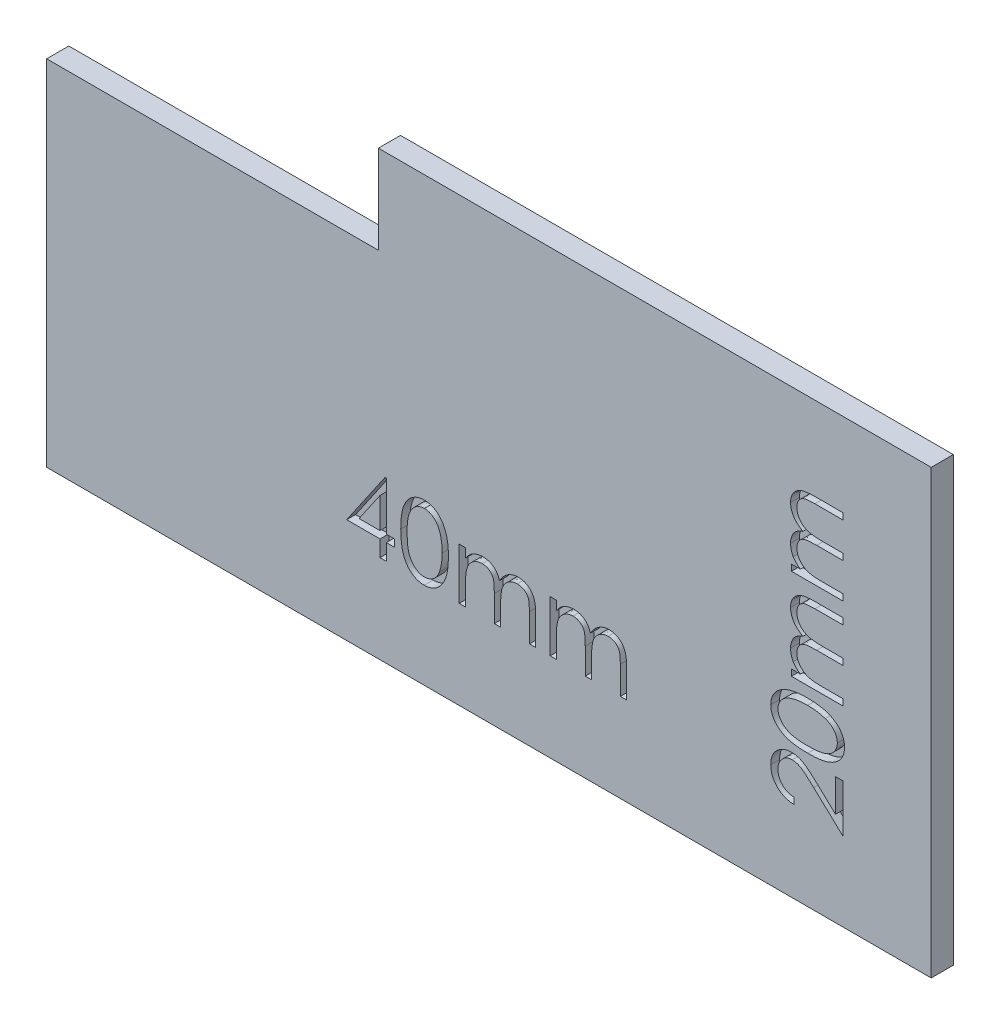
from build123d import *

# Parameters (mm, degrees)
SKETCH1_W           = 40
SKETCH1_H           = 20
BOSS_EXTRUDE1_DEPTH = 1
CUT_EXTRUDE1_REACH  = 46.733
SKETCH3_W           = 15
SKETCH3_H           = 4
CUT_EXTRUDE2_DEPTH  = 0.4


with BuildPart() as part:
    # Sketch1 → Boss-Extrude1 (new body)
    with BuildSketch(Plane.XY):
        with Locations((20, 10)):
            Rectangle(SKETCH1_W, SKETCH1_H)
    extrude(amount=BOSS_EXTRUDE1_DEPTH)

    # Sketch3 → Cut-Extrude1 (cut, up to next)
    with BuildSketch(Plane.XY.offset(1), mode=Mode.PRIVATE) as cut_extrude1_sk1:
        with Locations((7.5, 18)):
            Rectangle(SKETCH3_W, SKETCH3_H)
    cut_extrude1_tool1 = extrude(cut_extrude1_sk1.sketch, amount=-CUT_EXTRUDE1_REACH, mode=Mode.PRIVATE) & part.part
    add(cut_extrude1_tool1.solids().sort_by_distance((7.5, 18, 1))[0], mode=Mode.SUBTRACT)

    # Sketch2 → Cut-Extrude2 (cut)
    # profile 1 of 8: a face of its own
    with BuildSketch(Plane.XY.offset(1)):
        Polygon((15.30173778, 7.256410256), (15.359615385, 7.256410256), (15.359615385, 5.058333333), (15.725961538, 5.058333333), (15.725961538, 4.732692308), (15.359615385, 4.732692308), (15.359615385, 4), (15.074679487, 4), (15.074679487, 4.732692308), (13.568589744, 4.732692308), align=None)
        Polygon((15.074679487, 5.058333333), (15.074679487, 6.437219551), (14.128285256, 5.058333333), align=None, mode=Mode.SUBTRACT)
    # profile 2 of 8: a face of its own
    with BuildSketch(Plane.XY.offset(1)):
        with BuildLine():
            add(Edge.make_bspline(
                [(16.010897436, 5.586227965), (16.011194995, 5.637116309), (16.011773009, 5.735967652), (16.018203219, 5.880008006), (16.028885137, 6.015136268), (16.043524039, 6.141358907), (16.061338493, 6.258708507), (16.085119684, 6.366871466), (16.112164155, 6.466348394), (16.143508159, 6.557463681), (16.178875654, 6.641444883), (16.21736959, 6.719844887), (16.260517654, 6.792545069), (16.305853853, 6.860705779), (16.355213375, 6.923211273), (16.407191564, 6.98094426), (16.463817123, 7.032570441), (16.523165138, 7.079602444), (16.58577293, 7.120831607), (16.64985592, 7.15714702), (16.715855195, 7.188171185), (16.783950947, 7.212564652), (16.853531124, 7.232713063), (16.924838963, 7.246491609), (16.997992201, 7.25516109), (17.047369288, 7.255989917), (17.072410857, 7.256410256)],
                knots=[0, 0, 0, 0, 1.646270934, 3.197905019, 4.663502075, 6.030701355, 7.308322542, 8.50163776, 9.611534131, 10.641858119, 11.616356847, 12.558055219, 13.465016945, 14.349605745, 15.204443733, 16.039544428, 16.859896111, 17.680448484, 18.487036065, 19.28249412, 20.06191084, 20.843045899, 21.620316918, 22.403196591, 23.190181807, 24, 24, 24, 24], degree=3))
            add(Edge.make_bspline(
                [(17.072410857, 7.256410256), (17.097661613, 7.255967738), (17.147877421, 7.255087709), (17.222118333, 7.246629561), (17.294644115, 7.232595043), (17.36514557, 7.212709587), (17.434201808, 7.188039223), (17.501272692, 7.157117338), (17.56677483, 7.121122937), (17.629667305, 7.07882842), (17.690640563, 7.031673069), (17.74819693, 6.978366934), (17.802341643, 6.91944826), (17.853754242, 6.855547427), (17.900976105, 6.785438814), (17.94594629, 6.7103418), (17.986198065, 6.628943087), (18.024964521, 6.542600805), (18.058426287, 6.448925915), (18.088603524, 6.348446454), (18.112986588, 6.239975584), (18.133296857, 6.124082419), (18.149031155, 6.000341345), (18.160490766, 5.869017616), (18.166544208, 5.730024833), (18.167684215, 5.634994498), (18.168269231, 5.586227965)],
                knots=[0, 0, 0, 0, 0.810914788, 1.612654377, 2.396697861, 3.181598691, 3.963628158, 4.749916497, 5.551656086, 6.361998678, 7.18212741, 8.025565596, 8.878627764, 9.750805457, 10.657531673, 11.591944965, 12.560506719, 13.57287815, 14.630710178, 15.753379473, 16.941251878, 18.199788006, 19.531962791, 20.947069417, 22.433333509, 24, 24, 24, 24], degree=3))
            add(Edge.make_bspline(
                [(18.168269231, 5.586227965), (18.167678151, 5.537674134), (18.166526455, 5.443068975), (18.160558628, 5.30470159), (18.148803298, 5.174074794), (18.134098523, 5.050875303), (18.113732292, 4.935615891), (18.088690463, 4.827897713), (18.060886242, 4.727255591), (18.026564678, 4.634514012), (17.988999248, 4.548379235), (17.948127749, 4.467945464), (17.904340121, 4.392501756), (17.856634616, 4.322651986), (17.805786163, 4.257901347), (17.750706455, 4.199392789), (17.692948138, 4.145716537), (17.631795447, 4.097953989), (17.567922111, 4.056148487), (17.502644948, 4.018761637), (17.434805736, 3.988614835), (17.365941843, 3.962729477), (17.295068254, 3.942953353), (17.222273314, 3.929279212), (17.1479273, 3.919689035), (17.097670166, 3.918957443), (17.072410857, 3.918589744)],
                knots=[0, 0, 0, 0, 1.561518951, 3.042555995, 4.452378317, 5.7783523, 7.031515105, 8.214008947, 9.334062868, 10.386615937, 11.391082383, 12.354592575, 13.286541444, 14.194233754, 15.072674879, 15.931287219, 16.775624067, 17.606195743, 18.42308326, 19.229000347, 20.022332153, 20.807536673, 21.593273796, 22.3848459, 23.188221202, 24, 24, 24, 24], degree=3))
            add(Edge.make_bspline(
                [(17.072410857, 3.918589744), (17.047369983, 3.919012795), (16.997994265, 3.919846969), (16.924830993, 3.928477282), (16.853817634, 3.942352489), (16.784603764, 3.961780408), (16.716834283, 3.98556101), (16.651432651, 4.01654328), (16.587671681, 4.052224899), (16.525721484, 4.092860746), (16.466746166, 4.139416844), (16.41041386, 4.190910163), (16.358139736, 4.248625686), (16.309485949, 4.311652088), (16.263245169, 4.379409529), (16.220709809, 4.452823125), (16.181366248, 4.531601779), (16.145403939, 4.616254455), (16.11351908, 4.708016425), (16.085354373, 4.807937466), (16.06311653, 4.916899507), (16.044081992, 5.034027404), (16.028729159, 5.15982447), (16.018247735, 5.294358997), (16.011769543, 5.437547151), (16.011193443, 5.535763303), (16.010897436, 5.586227965)],
                knots=[0, 0, 0, 0, 0.810891512, 1.598919785, 2.382837074, 3.152667961, 3.926044502, 4.706494248, 5.493654104, 6.291793342, 7.103789334, 7.925228297, 8.761435821, 9.622817696, 10.50288917, 11.416980706, 12.369136599, 13.353924996, 14.394355917, 15.514179734, 16.714354668, 17.994756427, 19.357759367, 20.818452758, 22.365282078, 24, 24, 24, 24], degree=3))
        make_face()
        with BuildLine():
            add(Edge.make_bspline(
                [(16.295833333, 5.5875), (16.295941689, 5.545092252), (16.296151986, 5.46278714), (16.301645825, 5.343186467), (16.309129964, 5.231634812), (16.318783141, 5.127990532), (16.333118672, 5.03260445), (16.349181259, 4.944820523), (16.368728454, 4.865103315), (16.391856077, 4.792905801), (16.418198687, 4.727002717), (16.446960435, 4.665678758), (16.477858376, 4.608209501), (16.512437891, 4.555111156), (16.550097984, 4.506210565), (16.589988012, 4.46064221), (16.633596714, 4.420004948), (16.693925109, 4.371267015), (16.773569053, 4.32090323), (16.873917609, 4.27704642), (16.977031133, 4.249485191), (17.047018338, 4.245980213), (17.081951122, 4.244230769)],
                knots=[0, 0, 0, 0, 1.459021318, 2.831673884, 4.118529203, 5.306027144, 6.411944654, 7.436330062, 8.375795394, 9.233974572, 10.042671642, 10.816086306, 11.563610507, 12.285937304, 12.993564865, 13.685989202, 14.367179055, 15.041617293, 16.353048772, 17.594441528, 18.799311195, 20, 20, 20, 20], degree=3))
            add(Edge.make_bspline(
                [(17.081951122, 4.244230769), (17.117109867, 4.245680185), (17.187354767, 4.248576023), (17.289983281, 4.276514878), (17.389615026, 4.318669388), (17.467694572, 4.368514626), (17.527096594, 4.415983896), (17.569657006, 4.456455755), (17.608720436, 4.501772864), (17.645770032, 4.550667225), (17.679750765, 4.604072978), (17.710650897, 4.661733315), (17.738847934, 4.723808354), (17.754912569, 4.767142332), (17.763126002, 4.789297877)],
                knots=[0, 0, 0, 0, 1.353760809, 2.704726607, 4.075137775, 5.516104923, 6.260822281, 7.007110065, 7.778089737, 8.566572457, 9.372053459, 10.217411131, 11.088608312, 12, 12, 12, 12], degree=3))
            add(Edge.make_bspline(
                [(17.763126002, 4.789297877), (17.772697962, 4.817627712), (17.792133148, 4.875149426), (17.817180972, 4.964379311), (17.836907155, 5.057998961), (17.854653923, 5.155448888), (17.866767052, 5.25744776), (17.876516854, 5.36367998), (17.882259691, 5.474225644), (17.882971573, 5.549332529), (17.883333333, 5.5875)],
                knots=[0, 0, 0, 0, 0.884706709, 1.796334032, 2.740027952, 3.714592787, 4.726048262, 5.777819803, 6.87074269, 8, 8, 8, 8], degree=3))
            add(Edge.make_bspline(
                [(17.883333333, 5.5875), (17.882834233, 5.625661298), (17.881857886, 5.700312955), (17.878125912, 5.809640161), (17.868488812, 5.913478773), (17.857785326, 6.01227613), (17.842003561, 6.105485333), (17.82498755, 6.193886682), (17.802126451, 6.276384997), (17.777706369, 6.354271903), (17.749756939, 6.426662497), (17.718990523, 6.493894289), (17.686132213, 6.556291861), (17.650443181, 6.613684015), (17.612347097, 6.666327822), (17.570838463, 6.713167775), (17.527563782, 6.755655596), (17.466951049, 6.804153784), (17.387599372, 6.853603679), (17.28886082, 6.89911119), (17.186108164, 6.925244427), (17.116645102, 6.928928957), (17.081951122, 6.930769231)],
                knots=[0, 0, 0, 0, 1.31362396, 2.569729283, 3.763502607, 4.902122613, 5.988968491, 7.01645872, 7.998833611, 8.933434873, 9.825090667, 10.667526885, 11.477055099, 12.250526234, 12.991942729, 13.710640831, 14.402115721, 15.076753259, 16.378508321, 17.609869233, 18.806226677, 20, 20, 20, 20], degree=3))
            add(Edge.make_bspline(
                [(17.081951122, 6.930769231), (17.046835085, 6.928926418), (16.976539037, 6.925237437), (16.872718393, 6.899208557), (16.773200874, 6.853839652), (16.694059033, 6.80399), (16.633404026, 6.756511674), (16.590693297, 6.715339677), (16.550646412, 6.670303432), (16.513754999, 6.620953123), (16.479202578, 6.567916683), (16.447469802, 6.510776875), (16.418879081, 6.449244137), (16.392495252, 6.383370657), (16.36929708, 6.311179371), (16.350161842, 6.231560356), (16.332484301, 6.144055639), (16.319970021, 6.048152943), (16.308845043, 5.944482704), (16.301695534, 5.832652565), (16.296133608, 5.712851306), (16.29593543, 5.630120641), (16.295833333, 5.5875)],
                knots=[0, 0, 0, 0, 1.207732386, 2.417664972, 3.655092373, 4.956220595, 5.625982001, 6.301752483, 6.994047911, 7.697131622, 8.419323945, 9.170223765, 9.943494443, 10.752040957, 11.610060368, 12.549350801, 13.567764191, 14.679664412, 15.874934091, 17.154273443, 18.533957287, 20, 20, 20, 20], degree=3))
        make_face(mode=Mode.SUBTRACT)
    # profile 3 of 8: a face of its own
    with BuildSketch(Plane.XY.offset(1)):
        with BuildLine():
            Line((18.656730769, 6.320192308), (18.941666667, 6.320192308))
            Line((18.941666667, 6.320192308), (18.941666667, 5.916957131))
            add(Edge.make_bspline(
                [(18.941666667, 5.916957131), (18.96732425, 5.952233742), (19.016486639, 6.019827109), (19.097100481, 6.108899724), (19.177633097, 6.184490264), (19.235629808, 6.224171297), (19.263491587, 6.243234175)],
                knots=[0, 0, 0, 0, 1.134379233, 2.173579362, 3.122582517, 4, 4, 4, 4], degree=3))
            add(Edge.make_bspline(
                [(19.263491587, 6.243234175), (19.301468816, 6.261381899), (19.376759768, 6.297360285), (19.495975779, 6.333857871), (19.617963515, 6.35628707), (19.700339537, 6.359354459), (19.741776843, 6.360897436)],
                knots=[0, 0, 0, 0, 1.014936303, 2.012140481, 3.000054389, 4, 4, 4, 4], degree=3))
            add(Edge.make_bspline(
                [(19.741776843, 6.360897436), (19.769801204, 6.359949208), (19.825259908, 6.358072715), (19.907432618, 6.345862541), (19.98713293, 6.324756798), (20.063889943, 6.295358726), (20.136207988, 6.259756374), (20.202510331, 6.21798271), (20.262040863, 6.171086078), (20.314769495, 6.11694876), (20.362184968, 6.05405056), (20.405799351, 5.980695134), (20.446099365, 5.895235327), (20.468434409, 5.833217108), (20.480193309, 5.800565905)],
                knots=[0, 0, 0, 0, 1.009824226, 1.998387844, 2.986035974, 3.974953746, 4.955485308, 5.885931332, 6.793869504, 7.679848016, 8.601185859, 9.625726857, 10.749998409, 12, 12, 12, 12], degree=3))
            add(Edge.make_bspline(
                [(20.480193309, 5.800565905), (20.492631373, 5.822994486), (20.517107736, 5.867130782), (20.558206421, 5.929595063), (20.601266493, 5.988021224), (20.646654926, 6.042455623), (20.694211516, 6.09262945), (20.744160072, 6.13870859), (20.796216266, 6.180890926), (20.868599227, 6.230169792), (20.962772092, 6.282513007), (21.08150631, 6.327895953), (21.205013966, 6.355941298), (21.288850021, 6.359234474), (21.331184896, 6.360897436)],
                knots=[0, 0, 0, 0, 0.86119277, 1.694706429, 2.50939023, 3.298075842, 4.073795165, 4.829715201, 5.57930267, 6.321991688, 7.768977793, 9.186738141, 10.579381044, 12, 12, 12, 12], degree=3))
            add(Edge.make_bspline(
                [(21.331184896, 6.360897436), (21.370084509, 6.359430386), (21.446214827, 6.356559226), (21.557047061, 6.334013575), (21.660408556, 6.295298852), (21.756091332, 6.242472625), (21.842414877, 6.176088651), (21.917450386, 6.097104777), (21.980742073, 6.006079683), (22.022088411, 5.920452665), (22.050132972, 5.844855613), (22.067424234, 5.780442763), (22.082700243, 5.70954814), (22.09538323, 5.632086974), (22.104652917, 5.547785637), (22.111520637, 5.456782085), (22.116168904, 5.359005591), (22.116497355, 5.291545459), (22.116666667, 5.256770833)],
                knots=[0, 0, 0, 0, 1.209669288, 2.367440248, 3.500751976, 4.631527125, 5.755587489, 6.87532382, 8.007944318, 9.190864318, 9.82315674, 10.514484317, 11.263564316, 12.079023757, 12.955305781, 13.901327259, 14.918167583, 16, 16, 16, 16], degree=3))
            Line((22.116666667, 5.256770833), (22.116666667, 4))
            Line((22.116666667, 4), (21.831730769, 4))
            Line((21.831730769, 4), (21.831730769, 5.258042869))
            add(Edge.make_bspline(
                [(21.831730769, 5.258042869), (21.831660118, 5.287725104), (21.831524338, 5.344769845), (21.829080829, 5.426641711), (21.824476794, 5.501270864), (21.819093229, 5.568555544), (21.811614916, 5.628652659), (21.801957535, 5.681441496), (21.791727069, 5.727337311), (21.774730848, 5.778215368), (21.747563832, 5.834340488), (21.706182261, 5.894868303), (21.654048665, 5.947555886), (21.593850523, 5.993292502), (21.525317291, 6.030479591), (21.449784292, 6.057037114), (21.367720473, 6.073477153), (21.310912658, 6.075115467), (21.281575521, 6.075961538)],
                knots=[0, 0, 0, 0, 1.253487763, 2.409012846, 3.458416907, 4.410876679, 5.259312806, 6.014470957, 6.676830364, 7.243083969, 8.276244668, 9.299465089, 10.325150304, 11.392391894, 12.482080715, 13.603491619, 14.762376348, 16, 16, 16, 16], degree=3))
            add(Edge.make_bspline(
                [(21.281575521, 6.075961538), (21.245589205, 6.074676881), (21.174466564, 6.072137911), (21.070648159, 6.046217326), (20.970888737, 6.007137384), (20.878165009, 5.950502227), (20.79286837, 5.882640354), (20.719480896, 5.801950363), (20.658854556, 5.710664644), (20.617802735, 5.626167278), (20.591868155, 5.55026714), (20.574744096, 5.483957381), (20.561424162, 5.40859053), (20.548932325, 5.324673021), (20.540779171, 5.231627214), (20.533369291, 5.129883522), (20.529903222, 5.01913593), (20.529418392, 4.942367434), (20.529166667, 4.902509014)],
                knots=[0, 0, 0, 0, 1.090531906, 2.155305635, 3.229839962, 4.33261226, 5.44038871, 6.529323825, 7.629011124, 8.757537029, 9.370236727, 10.061839251, 10.834451254, 11.692844982, 12.636905849, 13.66920014, 14.789842145, 16, 16, 16, 16], degree=3))
            Line((20.529166667, 4.902509014), (20.529166667, 4))
            Line((20.529166667, 4), (20.244230769, 4))
            Line((20.244230769, 4), (20.244230769, 5.1798127))
            add(Edge.make_bspline(
                [(20.244230769, 5.1798127), (20.244158714, 5.213098782), (20.244020087, 5.277137859), (20.241592285, 5.368971264), (20.236977992, 5.452501958), (20.231643495, 5.527632857), (20.223968904, 5.59422742), (20.215251477, 5.652642665), (20.204956666, 5.702732146), (20.187911557, 5.757671788), (20.161863432, 5.818197197), (20.11996408, 5.882732266), (20.067705775, 5.939218326), (20.006409337, 5.987440905), (19.937461326, 6.027302106), (19.861276384, 6.056022023), (19.778540498, 6.072735486), (19.721501437, 6.074865908), (19.692167468, 6.075961538)],
                knots=[0, 0, 0, 0, 1.320475261, 2.540461679, 3.643808994, 4.639130445, 5.527981419, 6.302341397, 6.981980563, 7.553956391, 8.582137848, 9.585246428, 10.591171744, 11.620968678, 12.668337649, 13.738356861, 14.836885341, 16, 16, 16, 16], degree=3))
            add(Edge.make_bspline(
                [(19.692167468, 6.075961538), (19.657681333, 6.074573193), (19.588951692, 6.071806269), (19.487984905, 6.04690132), (19.390480035, 6.007890481), (19.297992558, 5.953770502), (19.213016723, 5.886733481), (19.138623509, 5.807889254), (19.07608279, 5.718219059), (19.034597501, 5.634612676), (19.007838171, 5.560614063), (18.990062403, 5.497702846), (18.974786456, 5.427852621), (18.963434451, 5.350847884), (18.952475788, 5.267190177), (18.947186865, 5.176462747), (18.942041948, 5.078743425), (18.941794829, 5.011276902), (18.941666667, 4.976287059)],
                knots=[0, 0, 0, 0, 1.098833095, 2.189935336, 3.297829714, 4.440610912, 5.596351641, 6.740013378, 7.886572111, 9.072425424, 9.705826452, 10.395263256, 11.156850408, 11.985370555, 12.878090359, 13.847760091, 14.883794034, 16, 16, 16, 16], degree=3))
            Line((18.941666667, 4.976287059), (18.941666667, 4))
            Line((18.941666667, 4), (18.656730769, 4))
            Line((18.656730769, 4), (18.656730769, 6.320192308))
        make_face()
    # profile 4 of 8: a face of its own
    with BuildSketch(Plane.XY.offset(1)):
        with BuildLine():
            Line((22.767948718, 6.320192308), (23.052884615, 6.320192308))
            Line((23.052884615, 6.320192308), (23.052884615, 5.916957131))
            add(Edge.make_bspline(
                [(23.052884615, 5.916957131), (23.078542199, 5.952233742), (23.127704588, 6.019827109), (23.20831843, 6.108899724), (23.288851046, 6.184490264), (23.346847756, 6.224171297), (23.374709535, 6.243234175)],
                knots=[0, 0, 0, 0, 1.134379233, 2.173579362, 3.122582517, 4, 4, 4, 4], degree=3))
            add(Edge.make_bspline(
                [(23.374709535, 6.243234175), (23.412686765, 6.261381899), (23.487977716, 6.297360285), (23.607193728, 6.333857871), (23.729181464, 6.35628707), (23.811557486, 6.359354459), (23.852994792, 6.360897436)],
                knots=[0, 0, 0, 0, 1.014936303, 2.012140481, 3.000054389, 4, 4, 4, 4], degree=3))
            add(Edge.make_bspline(
                [(23.852994792, 6.360897436), (23.881019153, 6.359949208), (23.936477857, 6.358072715), (24.018650567, 6.345862541), (24.098350879, 6.324756798), (24.175107891, 6.295358726), (24.247425936, 6.259756374), (24.31372828, 6.21798271), (24.373258812, 6.171086078), (24.425987444, 6.11694876), (24.473402917, 6.05405056), (24.517017299, 5.980695134), (24.557317313, 5.895235327), (24.579652358, 5.833217108), (24.591411258, 5.800565905)],
                knots=[0, 0, 0, 0, 1.009824226, 1.998387844, 2.986035974, 3.974953746, 4.955485308, 5.885931332, 6.793869504, 7.679848016, 8.601185859, 9.625726857, 10.749998409, 12, 12, 12, 12], degree=3))
            add(Edge.make_bspline(
                [(24.591411258, 5.800565905), (24.603849322, 5.822994486), (24.628325684, 5.867130782), (24.669424369, 5.929595063), (24.712484442, 5.988021224), (24.757872875, 6.042455623), (24.805429464, 6.09262945), (24.85537802, 6.13870859), (24.907434215, 6.180890926), (24.979817176, 6.230169792), (25.073990041, 6.282513007), (25.192724259, 6.327895953), (25.316231915, 6.355941298), (25.40006797, 6.359234474), (25.442402845, 6.360897436)],
                knots=[0, 0, 0, 0, 0.86119277, 1.694706429, 2.50939023, 3.298075842, 4.073795165, 4.829715201, 5.57930267, 6.321991688, 7.768977793, 9.186738141, 10.579381044, 12, 12, 12, 12], degree=3))
            add(Edge.make_bspline(
                [(25.442402845, 6.360897436), (25.481302457, 6.359430386), (25.557432776, 6.356559226), (25.66826501, 6.334013575), (25.771626505, 6.295298852), (25.867309281, 6.242472625), (25.953632826, 6.176088651), (26.028668335, 6.097104777), (26.091960022, 6.006079683), (26.133306359, 5.920452665), (26.161350921, 5.844855613), (26.178642183, 5.780442763), (26.193918192, 5.70954814), (26.206601179, 5.632086974), (26.215870866, 5.547785637), (26.222738586, 5.456782085), (26.227386853, 5.359005591), (26.227715304, 5.291545459), (26.227884615, 5.256770833)],
                knots=[0, 0, 0, 0, 1.209669288, 2.367440248, 3.500751976, 4.631527125, 5.755587489, 6.87532382, 8.007944318, 9.190864318, 9.82315674, 10.514484317, 11.263564316, 12.079023757, 12.955305781, 13.901327259, 14.918167583, 16, 16, 16, 16], degree=3))
            Line((26.227884615, 5.256770833), (26.227884615, 4))
            Line((26.227884615, 4), (25.942948718, 4))
            Line((25.942948718, 4), (25.942948718, 5.258042869))
            add(Edge.make_bspline(
                [(25.942948718, 5.258042869), (25.942878067, 5.287725104), (25.942742287, 5.344769845), (25.940298778, 5.426641711), (25.935694743, 5.501270864), (25.930311178, 5.568555544), (25.922832865, 5.628652659), (25.913175484, 5.681441496), (25.902945017, 5.727337311), (25.885948797, 5.778215368), (25.858781781, 5.834340488), (25.81740021, 5.894868303), (25.765266613, 5.947555886), (25.705068471, 5.993292502), (25.636535239, 6.030479591), (25.56100224, 6.057037114), (25.478938422, 6.073477153), (25.422130607, 6.075115467), (25.39279347, 6.075961538)],
                knots=[0, 0, 0, 0, 1.253487763, 2.409012846, 3.458416907, 4.410876679, 5.259312806, 6.014470957, 6.676830364, 7.243083969, 8.276244668, 9.299465089, 10.325150304, 11.392391894, 12.482080715, 13.603491619, 14.762376348, 16, 16, 16, 16], degree=3))
            add(Edge.make_bspline(
                [(25.39279347, 6.075961538), (25.356807154, 6.074676881), (25.285684513, 6.072137911), (25.181866108, 6.046217326), (25.082106685, 6.007137384), (24.989382958, 5.950502227), (24.904086319, 5.882640354), (24.830698845, 5.801950363), (24.770072505, 5.710664644), (24.729020684, 5.626167278), (24.703086104, 5.55026714), (24.685962044, 5.483957381), (24.672642111, 5.40859053), (24.660150273, 5.324673021), (24.65199712, 5.231627214), (24.64458724, 5.129883522), (24.641121171, 5.01913593), (24.640636341, 4.942367434), (24.640384615, 4.902509014)],
                knots=[0, 0, 0, 0, 1.090531906, 2.155305635, 3.229839962, 4.33261226, 5.44038871, 6.529323825, 7.629011124, 8.757537029, 9.370236727, 10.061839251, 10.834451254, 11.692844982, 12.636905849, 13.66920014, 14.789842145, 16, 16, 16, 16], degree=3))
            Line((24.640384615, 4.902509014), (24.640384615, 4))
            Line((24.640384615, 4), (24.355448718, 4))
            Line((24.355448718, 4), (24.355448718, 5.1798127))
            add(Edge.make_bspline(
                [(24.355448718, 5.1798127), (24.355376663, 5.213098782), (24.355238036, 5.277137859), (24.352810234, 5.368971264), (24.348195941, 5.452501958), (24.342861444, 5.527632857), (24.335186853, 5.59422742), (24.326469426, 5.652642665), (24.316174615, 5.702732146), (24.299129505, 5.757671788), (24.273081381, 5.818197197), (24.231182029, 5.882732266), (24.178923724, 5.939218326), (24.117627286, 5.987440905), (24.048679274, 6.027302106), (23.972494332, 6.056022023), (23.889758447, 6.072735486), (23.832719385, 6.074865908), (23.803385417, 6.075961538)],
                knots=[0, 0, 0, 0, 1.320475261, 2.540461679, 3.643808994, 4.639130445, 5.527981419, 6.302341397, 6.981980563, 7.553956391, 8.582137848, 9.585246428, 10.591171744, 11.620968678, 12.668337649, 13.738356861, 14.836885341, 16, 16, 16, 16], degree=3))
            add(Edge.make_bspline(
                [(23.803385417, 6.075961538), (23.768899282, 6.074573193), (23.70016964, 6.071806269), (23.599202853, 6.04690132), (23.501697983, 6.007890481), (23.409210507, 5.953770502), (23.324234672, 5.886733481), (23.249841458, 5.807889254), (23.187300739, 5.718219059), (23.145815449, 5.634612676), (23.119056119, 5.560614063), (23.101280351, 5.497702846), (23.086004405, 5.427852621), (23.0746524, 5.350847884), (23.063693737, 5.267190177), (23.058404814, 5.176462747), (23.053259897, 5.078743425), (23.053012778, 5.011276902), (23.052884615, 4.976287059)],
                knots=[0, 0, 0, 0, 1.098833095, 2.189935336, 3.297829714, 4.440610912, 5.596351641, 6.740013378, 7.886572111, 9.072425424, 9.705826452, 10.395263256, 11.156850408, 11.985370555, 12.878090359, 13.847760091, 14.883794034, 16, 16, 16, 16], degree=3))
            Line((23.052884615, 4.976287059), (23.052884615, 4))
            Line((23.052884615, 4), (22.767948718, 4))
            Line((22.767948718, 4), (22.767948718, 6.320192308))
        make_face()
    # profile 5 of 8: a face of its own
    with BuildSketch(Plane.XY.offset(1)):
        with BuildLine():
            Line((33.679807692, 12.767948718), (33.679807692, 13.052884615))
            Line((33.679807692, 13.052884615), (34.083042869, 13.052884615))
            add(Edge.make_bspline(
                [(34.083042869, 13.052884615), (34.047766258, 13.078542199), (33.980172891, 13.127704588), (33.891100276, 13.20831843), (33.815509736, 13.288851046), (33.775828703, 13.346847756), (33.756765825, 13.374709535)],
                knots=[0, 0, 0, 0, 1.134379233, 2.173579362, 3.122582517, 4, 4, 4, 4], degree=3))
            add(Edge.make_bspline(
                [(33.756765825, 13.374709535), (33.738618101, 13.412686765), (33.702639715, 13.487977716), (33.666142129, 13.607193728), (33.64371293, 13.729181464), (33.640645541, 13.811557486), (33.639102564, 13.852994792)],
                knots=[0, 0, 0, 0, 1.014936303, 2.012140481, 3.000054389, 4, 4, 4, 4], degree=3))
            add(Edge.make_bspline(
                [(33.639102564, 13.852994792), (33.640050807, 13.881019138), (33.641927329, 13.936477813), (33.654137287, 14.018650739), (33.675243847, 14.098350233), (33.704638871, 14.175110298), (33.740252318, 14.247417233), (33.781986994, 14.313758616), (33.828928901, 14.373030736), (33.882425774, 14.42618354), (33.945446327, 14.473559122), (34.019199176, 14.516832553), (34.104747332, 14.557348646), (34.166776911, 14.579663164), (34.199434095, 14.591411258)],
                knots=[0, 0, 0, 0, 1.009731074, 1.9982035, 2.985760524, 3.974587072, 4.955028184, 5.885388378, 6.793242796, 7.673688873, 8.594941726, 9.625945874, 10.750113716, 12, 12, 12, 12], degree=3))
            add(Edge.make_bspline(
                [(34.199434095, 14.591411258), (34.177005758, 14.603849549), (34.132869942, 14.628326359), (34.070402174, 14.669421795), (34.011988752, 14.712493737), (33.957508674, 14.75783961), (33.90739561, 14.805649855), (33.860627212, 14.855154145), (33.818498769, 14.907461094), (33.769204698, 14.979811598), (33.716676939, 15.073847292), (33.672282042, 15.192871011), (33.644009213, 15.316213342), (33.640748921, 15.400061738), (33.639102564, 15.442402845)],
                knots=[0, 0, 0, 0, 0.861026002, 1.694378253, 2.508904292, 3.297437177, 4.073006284, 4.833627155, 5.583069468, 6.325614666, 7.772320565, 9.187282923, 10.579656144, 12, 12, 12, 12], degree=3))
            add(Edge.make_bspline(
                [(33.639102564, 15.442402845), (33.640551236, 15.481309217), (33.643386428, 15.557452765), (33.666176269, 15.668117379), (33.703895541, 15.771765264), (33.756940583, 15.867297858), (33.823282236, 15.953605065), (33.902309405, 16.028911556), (33.993733461, 16.091561563), (34.079052599, 16.133444805), (34.154518194, 16.16132709), (34.219110555, 16.178740706), (34.290259971, 16.193827237), (34.367909216, 16.206618341), (34.452215505, 16.215865722), (34.543217575, 16.222740117), (34.640994503, 16.227386429), (34.708454573, 16.22771516), (34.743229167, 16.227884615)],
                knots=[0, 0, 0, 0, 1.209392158, 2.366897878, 3.497663982, 4.628180075, 5.751982922, 6.871462727, 8.009245026, 9.185977379, 9.818124946, 10.509294143, 11.264649411, 12.079922034, 12.956003306, 13.901808055, 14.918415426, 16, 16, 16, 16], degree=3))
            Line((34.743229167, 16.227884615), (36, 16.227884615))
            Line((36, 16.227884615), (36, 15.942948718))
            Line((36, 15.942948718), (34.741957131, 15.942948718))
            add(Edge.make_bspline(
                [(34.741957131, 15.942948718), (34.712274853, 15.94287841), (34.655230027, 15.942743289), (34.573358736, 15.94029527), (34.498727685, 15.935706128), (34.431239462, 15.930257725), (34.370915246, 15.92289305), (34.317923968, 15.913169384), (34.272023849, 15.902949923), (34.221160084, 15.885931802), (34.165097678, 15.858978339), (34.105078036, 15.817174693), (34.052424267, 15.765295422), (34.006713026, 15.705060448), (33.969518869, 15.636537475), (33.942963317, 15.561001616), (33.926522729, 15.478938593), (33.924884492, 15.422130665), (33.924038462, 15.39279347)],
                knots=[0, 0, 0, 0, 1.253367865, 2.408782419, 3.458086102, 4.410454771, 5.267690823, 6.022776742, 6.685072793, 7.251272234, 8.28433411, 9.300106008, 10.325693114, 11.39283262, 12.482417211, 13.60372085, 14.762494729, 16, 16, 16, 16], degree=3))
            add(Edge.make_bspline(
                [(33.924038462, 15.39279347), (33.925681574, 15.356836503), (33.92892609, 15.285835267), (33.953319292, 15.1815859), (33.993862117, 15.082472707), (34.049311102, 14.989164845), (34.11742671, 14.904121368), (34.1980316, 14.830689474), (34.289340415, 14.770074923), (34.37383213, 14.729021079), (34.44973281, 14.703084675), (34.516043517, 14.685968942), (34.591612039, 14.672574946), (34.675552281, 14.660256513), (34.768578997, 14.651943035), (34.870117775, 14.64459899), (34.980863704, 14.64111785), (35.057632441, 14.640635206), (35.097490986, 14.640384615)],
                knots=[0, 0, 0, 0, 1.091136677, 2.154576964, 3.231646693, 4.331257757, 5.439166191, 6.528231045, 7.628049365, 8.756709726, 9.369482423, 10.061167346, 10.833871401, 11.698739631, 12.636505159, 13.668922441, 14.789697963, 16, 16, 16, 16], degree=3))
            Line((35.097490986, 14.640384615), (36, 14.640384615))
            Line((36, 14.640384615), (36, 14.355448718))
            Line((36, 14.355448718), (34.8201873, 14.355448718))
            add(Edge.make_bspline(
                [(34.8201873, 14.355448718), (34.786901218, 14.355376663), (34.722862142, 14.355238035), (34.631028735, 14.352810234), (34.547498045, 14.348195938), (34.472367131, 14.342861453), (34.405772615, 14.335186823), (34.347357228, 14.326469517), (34.297268179, 14.316174341), (34.242326874, 14.299130635), (34.181812366, 14.273073309), (34.117233597, 14.231210844), (34.060813545, 14.178724448), (34.011902548, 14.117834122), (33.971935315, 14.048788957), (33.944158391, 13.972352558), (33.927211729, 13.889777004), (33.925116165, 13.832725687), (33.924038462, 13.803385417)],
                knots=[0, 0, 0, 0, 1.320285835, 2.540097241, 3.643286278, 4.638464947, 5.527188413, 6.301437306, 6.980978976, 7.552872752, 8.580906713, 9.583871393, 10.589652407, 11.624542289, 12.671761011, 13.738681301, 14.837052193, 16, 16, 16, 16], degree=3))
            add(Edge.make_bspline(
                [(33.924038462, 13.803385417), (33.925426812, 13.768899291), (33.928193745, 13.700169666), (33.953098626, 13.59920275), (33.992109726, 13.501698385), (34.046228697, 13.40920895), (34.113269531, 13.324240524), (34.192099631, 13.249819859), (34.28166689, 13.187491517), (34.364911668, 13.145724854), (34.438933365, 13.1189483), (34.502116542, 13.101392719), (34.572141665, 13.085983464), (34.649153833, 13.074658693), (34.732809304, 13.063691836), (34.823537406, 13.058405377), (34.921256532, 13.053259739), (34.988723083, 13.053012724), (35.023712941, 13.052884615)],
                knots=[0, 0, 0, 0, 1.09880202, 2.189873405, 3.297736452, 4.440485332, 5.596193377, 6.739822772, 7.886349079, 9.066114917, 9.699498033, 10.395421758, 11.156987371, 11.985484089, 12.878178647, 13.847820956, 14.883825601, 16, 16, 16, 16], degree=3))
            Line((35.023712941, 13.052884615), (36, 13.052884615))
            Line((36, 13.052884615), (36, 12.767948718))
            Line((36, 12.767948718), (33.679807692, 12.767948718))
        make_face()
    # profile 6 of 8: a face of its own
    with BuildSketch(Plane.XY.offset(1)):
        with BuildLine():
            Line((33.679807692, 8.656730769), (33.679807692, 8.941666667))
            Line((33.679807692, 8.941666667), (34.083042869, 8.941666667))
            add(Edge.make_bspline(
                [(34.083042869, 8.941666667), (34.047766258, 8.96732425), (33.980172891, 9.016486639), (33.891100276, 9.097100481), (33.815509736, 9.177633097), (33.775828703, 9.235629808), (33.756765825, 9.263491587)],
                knots=[0, 0, 0, 0, 1.134379233, 2.173579362, 3.122582517, 4, 4, 4, 4], degree=3))
            add(Edge.make_bspline(
                [(33.756765825, 9.263491587), (33.738618101, 9.301468816), (33.702639715, 9.376759768), (33.666142129, 9.495975779), (33.64371293, 9.617963515), (33.640645541, 9.700339537), (33.639102564, 9.741776843)],
                knots=[0, 0, 0, 0, 1.014936303, 2.012140481, 3.000054389, 4, 4, 4, 4], degree=3))
            add(Edge.make_bspline(
                [(33.639102564, 9.741776843), (33.640050807, 9.769801189), (33.641927329, 9.825259864), (33.654137287, 9.90743279), (33.675243847, 9.987132285), (33.704638871, 10.063892349), (33.740252318, 10.136199284), (33.781986994, 10.202540668), (33.828928901, 10.261812787), (33.882425774, 10.314965591), (33.945446327, 10.362341174), (34.019199176, 10.405614605), (34.104747332, 10.446130697), (34.166776911, 10.468445215), (34.199434095, 10.480193309)],
                knots=[0, 0, 0, 0, 1.009731074, 1.9982035, 2.985760524, 3.974587072, 4.955028184, 5.885388378, 6.793242796, 7.673688873, 8.594941726, 9.625945874, 10.750113716, 12, 12, 12, 12], degree=3))
            add(Edge.make_bspline(
                [(34.199434095, 10.480193309), (34.177005758, 10.4926316), (34.132869942, 10.517108411), (34.070402174, 10.558203846), (34.011988752, 10.601275788), (33.957508674, 10.646621662), (33.90739561, 10.694431906), (33.860627212, 10.743936196), (33.818498769, 10.796243146), (33.769204698, 10.868593649), (33.716676939, 10.962629343), (33.672282042, 11.081653062), (33.644009213, 11.204995394), (33.640748921, 11.288843789), (33.639102564, 11.331184896)],
                knots=[0, 0, 0, 0, 0.861026002, 1.694378253, 2.508904292, 3.297437177, 4.073006284, 4.833627155, 5.583069468, 6.325614666, 7.772320565, 9.187282923, 10.579656144, 12, 12, 12, 12], degree=3))
            add(Edge.make_bspline(
                [(33.639102564, 11.331184896), (33.640551236, 11.370091268), (33.643386428, 11.446234816), (33.666176269, 11.55689943), (33.703895541, 11.660547315), (33.756940583, 11.75607991), (33.823282236, 11.842387116), (33.902309405, 11.917693608), (33.993733461, 11.980343614), (34.079052599, 12.022226856), (34.154518194, 12.050109141), (34.219110555, 12.067522758), (34.290259971, 12.082609289), (34.367909216, 12.095400392), (34.452215505, 12.104647773), (34.543217575, 12.111522168), (34.640994503, 12.11616848), (34.708454573, 12.116497211), (34.743229167, 12.116666667)],
                knots=[0, 0, 0, 0, 1.209392158, 2.366897878, 3.497663982, 4.628180075, 5.751982922, 6.871462727, 8.009245026, 9.185977379, 9.818124946, 10.509294143, 11.264649411, 12.079922034, 12.956003306, 13.901808055, 14.918415426, 16, 16, 16, 16], degree=3))
            Line((34.743229167, 12.116666667), (36, 12.116666667))
            Line((36, 12.116666667), (36, 11.831730769))
            Line((36, 11.831730769), (34.741957131, 11.831730769))
            add(Edge.make_bspline(
                [(34.741957131, 11.831730769), (34.712274853, 11.831660461), (34.655230027, 11.83152534), (34.573358736, 11.829077322), (34.498727685, 11.824488179), (34.431239462, 11.819039776), (34.370915246, 11.811675102), (34.317923968, 11.801951435), (34.272023849, 11.791731974), (34.221160084, 11.774713853), (34.165097678, 11.747760391), (34.105078036, 11.705956744), (34.052424267, 11.654077473), (34.006713026, 11.593842499), (33.969518869, 11.525319526), (33.942963317, 11.449783667), (33.926522729, 11.367720644), (33.924884492, 11.310912716), (33.924038462, 11.281575521)],
                knots=[0, 0, 0, 0, 1.253367865, 2.408782419, 3.458086102, 4.410454771, 5.267690823, 6.022776742, 6.685072793, 7.251272234, 8.28433411, 9.300106008, 10.325693114, 11.39283262, 12.482417211, 13.60372085, 14.762494729, 16, 16, 16, 16], degree=3))
            add(Edge.make_bspline(
                [(33.924038462, 11.281575521), (33.925681574, 11.245618554), (33.92892609, 11.174617318), (33.953319292, 11.070367951), (33.993862117, 10.971254758), (34.049311102, 10.877946896), (34.11742671, 10.792903419), (34.1980316, 10.719471525), (34.289340415, 10.658856974), (34.37383213, 10.61780313), (34.44973281, 10.591866726), (34.516043517, 10.574750993), (34.591612039, 10.561356997), (34.675552281, 10.549038564), (34.768578997, 10.540725087), (34.870117775, 10.533381042), (34.980863704, 10.529899901), (35.057632441, 10.529417257), (35.097490986, 10.529166667)],
                knots=[0, 0, 0, 0, 1.091136677, 2.154576964, 3.231646693, 4.331257757, 5.439166191, 6.528231045, 7.628049365, 8.756709726, 9.369482423, 10.061167346, 10.833871401, 11.698739631, 12.636505159, 13.668922441, 14.789697963, 16, 16, 16, 16], degree=3))
            Line((35.097490986, 10.529166667), (36, 10.529166667))
            Line((36, 10.529166667), (36, 10.244230769))
            Line((36, 10.244230769), (34.8201873, 10.244230769))
            add(Edge.make_bspline(
                [(34.8201873, 10.244230769), (34.786901218, 10.244158714), (34.722862142, 10.244020087), (34.631028735, 10.241592286), (34.547498045, 10.236977989), (34.472367131, 10.231643504), (34.405772615, 10.223968875), (34.347357228, 10.215251568), (34.297268179, 10.204956392), (34.242326874, 10.187912686), (34.181812366, 10.16185536), (34.117233597, 10.119992895), (34.060813545, 10.067506499), (34.011902548, 10.006616173), (33.971935315, 9.937571008), (33.944158391, 9.861134609), (33.927211729, 9.778559055), (33.925116165, 9.721507739), (33.924038462, 9.692167468)],
                knots=[0, 0, 0, 0, 1.320285835, 2.540097241, 3.643286278, 4.638464947, 5.527188413, 6.301437306, 6.980978976, 7.552872752, 8.580906713, 9.583871393, 10.589652407, 11.624542289, 12.671761011, 13.738681301, 14.837052193, 16, 16, 16, 16], degree=3))
            add(Edge.make_bspline(
                [(33.924038462, 9.692167468), (33.925426812, 9.657681342), (33.928193745, 9.588951718), (33.953098626, 9.487984801), (33.992109726, 9.390480436), (34.046228697, 9.297991001), (34.113269531, 9.213022575), (34.192099631, 9.13860191), (34.28166689, 9.076273569), (34.364911668, 9.034506905), (34.438933365, 9.007730351), (34.502116542, 8.990174771), (34.572141665, 8.974765515), (34.649153833, 8.963440744), (34.732809304, 8.952473887), (34.823537406, 8.947187428), (34.921256532, 8.94204179), (34.988723083, 8.941794775), (35.023712941, 8.941666667)],
                knots=[0, 0, 0, 0, 1.09880202, 2.189873405, 3.297736452, 4.440485332, 5.596193377, 6.739822772, 7.886349079, 9.066114917, 9.699498033, 10.395421758, 11.156987371, 11.985484089, 12.878178647, 13.847820956, 14.883825601, 16, 16, 16, 16], degree=3))
            Line((35.023712941, 8.941666667), (36, 8.941666667))
            Line((36, 8.941666667), (36, 8.656730769))
            Line((36, 8.656730769), (33.679807692, 8.656730769))
        make_face()
    # profile 7 of 8: a face of its own
    with BuildSketch(Plane.XY.offset(1)):
        with BuildLine():
            add(Edge.make_bspline(
                [(34.413772035, 6.010897436), (34.362883691, 6.011194995), (34.264032348, 6.011773008), (34.119991994, 6.018203219), (33.984863732, 6.028885136), (33.858641094, 6.04352404), (33.741291491, 6.061338491), (33.63312854, 6.085119689), (33.533651586, 6.112164137), (33.442536383, 6.143508219), (33.358554894, 6.178875446), (33.280155901, 6.217370325), (33.207452134, 6.260515049), (33.139304243, 6.305863187), (33.076753039, 6.355180138), (33.019077814, 6.407408452), (32.966764954, 6.463592703), (32.919778634, 6.523187954), (32.878578488, 6.585790301), (32.842064493, 6.649689056), (32.811988111, 6.716025948), (32.787384802, 6.783927689), (32.767300553, 6.853537389), (32.753504732, 6.924837279), (32.744839858, 6.997992637), (32.744010402, 7.047369435), (32.743589744, 7.072410857)],
                knots=[0, 0, 0, 0, 1.646148282, 3.197666765, 4.66315463, 6.030252048, 7.307778049, 8.501004361, 9.610818041, 10.641065266, 11.615491391, 12.557119604, 13.464013759, 14.348536654, 15.203310953, 16.038349431, 16.863300206, 17.683791446, 18.490318933, 19.285717724, 20.06220424, 20.843281102, 21.620494212, 22.403315558, 23.190242141, 24, 24, 24, 24], degree=3))
            add(Edge.make_bspline(
                [(32.743589744, 7.072410857), (32.743940127, 7.097673859), (32.744637268, 7.14793834), (32.75444994, 7.22198401), (32.76711544, 7.294739931), (32.787428816, 7.365102251), (32.811736404, 7.434401388), (32.843809882, 7.50091401), (32.878692279, 7.566988365), (32.921245869, 7.629622783), (32.968274589, 7.690688666), (33.021664209, 7.747931556), (33.079937166, 7.802814734), (33.144393116, 7.853265283), (33.21404376, 7.901445445), (33.28947297, 7.945526251), (33.370513584, 7.986424502), (33.456789911, 8.024908976), (33.550606524, 8.058562632), (33.651378265, 8.088483423), (33.76001767, 8.113008574), (33.875919549, 8.133290443), (33.999658079, 8.149033033), (34.130982551, 8.160490225), (34.269975122, 8.166544355), (34.365005487, 8.167684265), (34.413772035, 8.168269231)],
                knots=[0, 0, 0, 0, 0.810910589, 1.61342667, 2.396193133, 3.181089899, 3.963115317, 4.752255436, 5.550715454, 6.36105385, 7.181178335, 8.024612154, 8.872680183, 9.750181803, 10.651284446, 11.591556747, 12.554036451, 13.566402641, 14.62422919, 15.753422176, 16.94128843, 18.199818041, 19.531985927, 20.947085226, 22.433341622, 24, 24, 24, 24], degree=3))
            add(Edge.make_bspline(
                [(34.413772035, 8.168269231), (34.462325441, 8.167671396), (34.557141539, 8.166503931), (34.695515231, 8.160620069), (34.826131835, 8.148753187), (34.949130608, 8.134125762), (35.064568578, 8.113617205), (35.172370524, 8.088906089), (35.272918116, 8.060751449), (35.365490942, 8.026581299), (35.451617553, 7.988992582), (35.532062281, 7.948138218), (35.607471571, 7.904306167), (35.677305929, 7.856848596), (35.741503164, 7.805568187), (35.799975986, 7.750723477), (35.853705187, 7.69298079), (35.901252024, 7.631558903), (35.944129596, 7.568341084), (35.980277855, 7.502260016), (36.011598201, 7.435006892), (36.037205473, 7.365910255), (36.057064212, 7.295076784), (36.070716013, 7.222270995), (36.08031218, 7.14792789), (36.081042964, 7.097670363), (36.081410256, 7.072410857)],
                knots=[0, 0, 0, 0, 1.561645053, 3.049612875, 4.452756685, 5.778837748, 7.032101753, 8.221335837, 9.334924186, 10.387562255, 11.392109817, 12.355697819, 13.287721948, 14.19548756, 15.068665045, 15.927346723, 16.771751757, 17.602390507, 18.423119567, 19.225778204, 20.022010933, 20.807278863, 21.593079439, 22.384715467, 23.188155646, 24, 24, 24, 24], degree=3))
            add(Edge.make_bspline(
                [(36.081410256, 7.072410857), (36.080987205, 7.047369983), (36.080153031, 6.997994265), (36.071522718, 6.924830993), (36.057647511, 6.853817635), (36.038219593, 6.784603762), (36.014438985, 6.716834291), (35.983456742, 6.651432619), (35.947775018, 6.587671803), (35.907139569, 6.525721017), (35.860581952, 6.466747949), (35.809094419, 6.410407075), (35.751356655, 6.358165882), (35.68827768, 6.309276553), (35.620028397, 6.263449003), (35.546563005, 6.220677107), (35.46775606, 6.181374962), (35.383110858, 6.145403492), (35.29134896, 6.11351077), (35.191618431, 6.085448289), (35.082906305, 6.063035647), (34.965764536, 6.044037468), (34.8399551, 6.028813979), (34.705432482, 6.018207655), (34.562452128, 6.01177789), (34.464236452, 6.011196276), (34.413772035, 6.010897436)],
                knots=[0, 0, 0, 0, 0.810927267, 1.598990287, 2.382942141, 3.152806972, 3.926217614, 4.706701772, 5.493896336, 6.292070767, 7.104102563, 7.925577746, 8.761822141, 9.623241997, 10.509042271, 11.423174113, 12.375371989, 13.360203808, 14.400680605, 15.520553799, 16.714061498, 17.994519714, 19.364400916, 20.818312473, 22.365209998, 24, 24, 24, 24], degree=3))
        make_face()
        with BuildLine():
            add(Edge.make_bspline(
                [(34.4125, 6.295833333), (34.454907579, 6.295944065), (34.537212362, 6.296158973), (34.656603995, 6.301610818), (34.768147671, 6.30919923), (34.871799856, 6.318745888), (34.967198289, 6.333043367), (35.054739575, 6.349264731), (35.134261677, 6.368721268), (35.206459525, 6.391855355), (35.272355467, 6.418207331), (35.333705866, 6.446928541), (35.391237837, 6.478056698), (35.4448118, 6.512229861), (35.493772872, 6.550123658), (35.539362103, 6.589981327), (35.579993941, 6.633598435), (35.628733605, 6.693924148), (35.679096573, 6.773569359), (35.72295363, 6.873917532), (35.750514796, 6.977031151), (35.754019783, 7.047018344), (35.755769231, 7.081951122)],
                knots=[0, 0, 0, 0, 1.459098681, 2.831824031, 4.11146945, 5.306290378, 6.412266529, 7.42953815, 8.369053297, 9.227277979, 10.03601793, 10.809473603, 11.557037441, 12.285528272, 12.993193355, 13.685654407, 14.36688038, 15.041354379, 16.352855396, 17.594313975, 18.799247529, 20, 20, 20, 20], degree=3))
            add(Edge.make_bspline(
                [(35.755769231, 7.081951122), (35.75423738, 7.117086112), (35.751179113, 7.18723146), (35.724487765, 7.290250359), (35.681096109, 7.389434172), (35.631522171, 7.467708985), (35.584009028, 7.527093822), (35.543546211, 7.569657776), (35.498226589, 7.608720221), (35.449332926, 7.645770092), (35.395926979, 7.679750748), (35.338266698, 7.710650902), (35.276191642, 7.738847933), (35.232857667, 7.754912568), (35.210702123, 7.763126002)],
                knots=[0, 0, 0, 0, 1.353621445, 2.702441307, 4.075953605, 5.516772412, 6.261413105, 7.007624062, 7.778524365, 8.566925914, 9.372323995, 10.217594641, 11.088702136, 12, 12, 12, 12], degree=3))
            add(Edge.make_bspline(
                [(35.210702123, 7.763126002), (35.182372288, 7.772697962), (35.124850574, 7.792133148), (35.035620689, 7.817180972), (34.942001039, 7.836907155), (34.844551112, 7.854653923), (34.74255224, 7.866767052), (34.63632002, 7.876516854), (34.525774356, 7.882259691), (34.450667471, 7.882971573), (34.4125, 7.883333333)],
                knots=[0, 0, 0, 0, 0.884706709, 1.796334032, 2.740027952, 3.714592787, 4.726048262, 5.777819803, 6.87074269, 8, 8, 8, 8], degree=3))
            add(Edge.make_bspline(
                [(34.4125, 7.883333333), (34.374338702, 7.882834233), (34.299687045, 7.881857886), (34.190359839, 7.878125912), (34.086521227, 7.868488812), (33.98772387, 7.857785325), (33.894514665, 7.842003562), (33.806113324, 7.824987545), (33.723614983, 7.80212647), (33.645728166, 7.777706302), (33.573337263, 7.749757172), (33.50610654, 7.718989717), (33.44370523, 7.68613504), (33.386326138, 7.650433313), (33.333636439, 7.612381828), (33.286848519, 7.570616271), (33.243686403, 7.527789065), (33.195298485, 7.46687975), (33.145571911, 7.387787151), (33.101055337, 7.288690359), (33.074709227, 7.186129452), (33.071055605, 7.116652193), (33.069230769, 7.081951122)],
                knots=[0, 0, 0, 0, 1.313483664, 2.569454835, 3.763100662, 4.901599063, 5.988328865, 7.015709358, 7.99797933, 8.932480776, 9.824041341, 10.666387587, 11.475829342, 12.24921787, 12.990555181, 13.709176526, 14.405678811, 15.080244297, 16.38186033, 17.610124501, 18.806354173, 20, 20, 20, 20], degree=3))
            add(Edge.make_bspline(
                [(33.069230769, 7.081951122), (33.071060145, 7.04682975), (33.07472223, 6.976523025), (33.100933494, 6.872866863), (33.145441664, 6.773100612), (33.195202681, 6.693747195), (33.243500879, 6.633577826), (33.284608206, 6.590880231), (33.32910856, 6.55046979), (33.378503972, 6.513557249), (33.431889166, 6.479586723), (33.488677149, 6.447255573), (33.55014218, 6.418918441), (33.615986452, 6.392481863), (33.68818827, 6.369309189), (33.767998111, 6.350074966), (33.855748452, 6.332564479), (33.95184392, 6.319954075), (34.055518227, 6.308849777), (34.167347158, 6.301694125), (34.287148771, 6.296133998), (34.369879385, 6.295935562), (34.4125, 6.295833333)],
                knots=[0, 0, 0, 0, 1.207546505, 2.417292871, 3.651582144, 4.952510111, 5.626719005, 6.30238548, 6.989136872, 7.692112372, 8.420316868, 9.164734959, 9.937886623, 10.746308695, 11.604196049, 12.543341915, 13.568754172, 14.680483261, 15.875568977, 17.154711427, 18.534182925, 20, 20, 20, 20], degree=3))
        make_face(mode=Mode.SUBTRACT)
    # profile 8 of 8: a face of its own
    with BuildSketch(Plane.XY.offset(1)):
        with BuildLine():
            Line((33.801923077, 3.975641026), (33.801923077, 3.690705128))
            add(Edge.make_bspline(
                [(33.801923077, 3.690705128), (33.764121629, 3.692562188), (33.689880591, 3.696209405), (33.581636761, 3.713289353), (33.478172765, 3.737728578), (33.380319343, 3.772282968), (33.287211282, 3.81519652), (33.199218411, 3.866658759), (33.116676404, 3.927613181), (33.040350453, 3.996743575), (32.9703303, 4.071826555), (32.909864472, 4.1528398), (32.858776299, 4.237970646), (32.816066887, 4.326960815), (32.784008598, 4.420814327), (32.760221825, 4.51867949), (32.745910426, 4.620986278), (32.744372106, 4.690691156), (32.743589744, 4.726141827)],
                knots=[0, 0, 0, 0, 1.10065271, 2.161652631, 3.183658789, 4.190468796, 5.17591951, 6.163126047, 7.15150782, 8.156236427, 9.156009102, 10.134482811, 11.092018607, 12.041330605, 13.001268258, 13.972401359, 14.968799086, 16, 16, 16, 16], degree=3))
            add(Edge.make_bspline(
                [(32.743589744, 4.726141827), (32.744398158, 4.760958673), (32.745986663, 4.829372531), (32.759833448, 4.929179842), (32.781052412, 5.024419953), (32.812495573, 5.11401351), (32.851949863, 5.198879993), (32.901016441, 5.277968616), (32.957373643, 5.353191822), (33.023849726, 5.42085779), (33.094779874, 5.483017143), (33.170532676, 5.536594748), (33.248863406, 5.582736203), (33.330383941, 5.620501543), (33.415359751, 5.649129349), (33.502976144, 5.670339811), (33.594244272, 5.682464857), (33.656028425, 5.68431552), (33.687439904, 5.68525641)],
                knots=[0, 0, 0, 0, 1.111674182, 2.184400057, 3.212814286, 4.223731311, 5.211378316, 6.196328225, 7.191884489, 8.207283132, 9.220262353, 10.201199469, 11.166417575, 12.120932471, 13.06540007, 14.026332106, 14.996573967, 16, 16, 16, 16], degree=3))
            add(Edge.make_bspline(
                [(33.687439904, 5.68525641), (33.731661135, 5.683720355), (33.819327577, 5.6806752), (33.948155624, 5.654627512), (34.072971449, 5.613943973), (34.173429426, 5.564964997), (34.254369289, 5.515540993), (34.321044076, 5.471047335), (34.392816005, 5.418663925), (34.469975571, 5.358838304), (34.551512304, 5.290540189), (34.639089773, 5.215543956), (34.73108861, 5.131912802), (34.793965992, 5.073267258), (34.826547476, 5.042878606)],
                knots=[0, 0, 0, 0, 1.184416499, 2.348048165, 3.509039915, 4.696071444, 5.333504901, 6.05069495, 6.844171097, 7.714965912, 8.667477798, 9.695072654, 10.805644396, 12, 12, 12, 12], degree=3))
            Line((34.826547476, 5.042878606), (35.674358974, 4.248492588))
            Line((35.674358974, 4.248492588), (35.674358974, 5.725961538))
            Line((35.674358974, 5.725961538), (36, 5.725961538))
            Line((36, 5.725961538), (36, 3.568589744))
            Line((36, 3.568589744), (34.68598758, 4.799919872))
            add(Edge.make_bspline(
                [(34.68598758, 4.799919872), (34.654692688, 4.829899026), (34.594581604, 4.887482847), (34.506821919, 4.96892847), (34.425406264, 5.042079552), (34.350488467, 5.107409616), (34.280972687, 5.163501438), (34.219110349, 5.213278392), (34.162183098, 5.253161463), (34.096196969, 5.296446144), (34.01563151, 5.338368827), (33.917175949, 5.374393607), (33.81582337, 5.396359934), (33.747332236, 5.398995035), (33.712880609, 5.400320513)],
                knots=[0, 0, 0, 0, 1.329631726, 2.553950428, 3.673215718, 4.687767853, 5.603093632, 6.413772471, 7.123043292, 7.734684054, 8.834405432, 9.900288307, 10.943827018, 12, 12, 12, 12], degree=3))
            add(Edge.make_bspline(
                [(33.712880609, 5.400320513), (33.691216769, 5.399743804), (33.6485215, 5.398607221), (33.585923419, 5.38857631), (33.525539624, 5.373417493), (33.467184376, 5.351695724), (33.411444392, 5.323023895), (33.358251821, 5.288123043), (33.306826831, 5.247854914), (33.258609196, 5.201271977), (33.214448388, 5.15009867), (33.175328682, 5.096038172), (33.14263606, 5.03884272), (33.115835888, 4.978753467), (33.094812506, 4.915937934), (33.080245081, 4.850274629), (33.071098827, 4.781944986), (33.069861329, 4.735287458), (33.069230769, 4.711513421)],
                knots=[0, 0, 0, 0, 0.991446411, 1.95395049, 2.89581595, 3.838931463, 4.798493298, 5.75982156, 6.748411868, 7.785213223, 8.824556874, 9.840280684, 10.836137867, 11.835679398, 12.848801643, 13.863922112, 14.911575587, 16, 16, 16, 16], degree=3))
            add(Edge.make_bspline(
                [(33.069230769, 4.711513421), (33.069853811, 4.686677934), (33.071077364, 4.637905138), (33.080345157, 4.566447871), (33.094395137, 4.497810049), (33.116709571, 4.433015811), (33.143075184, 4.370662077), (33.176569854, 4.312080002), (33.215491405, 4.256296943), (33.26062253, 4.204230424), (33.311330612, 4.156677122), (33.367214419, 4.114307817), (33.427871631, 4.077531265), (33.493053301, 4.04539925), (33.563408394, 4.019316758), (33.638671179, 3.999383113), (33.718519364, 3.983611), (33.773660089, 3.978341808), (33.801923077, 3.975641026)],
                knots=[0, 0, 0, 0, 1.030878251, 2.024474673, 2.987898669, 3.934362936, 4.864849709, 5.795128259, 6.730474222, 7.685293701, 8.650606017, 9.611896181, 10.591709709, 11.591680886, 12.625074257, 13.701333388, 14.821793024, 16, 16, 16, 16], degree=3))
        make_face()
    extrude(amount=-CUT_EXTRUDE2_DEPTH, mode=Mode.SUBTRACT)


solid = part.part
